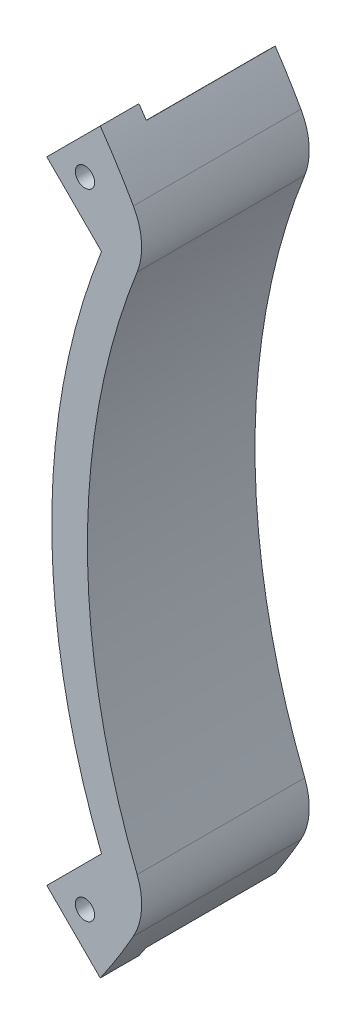
from build123d import *
from build123d.topology import SkipClean

# Parameters (mm, degrees)
CROQUIS1_R              = 100
SALIENTE_EXTRUIR1_DEPTH = 3
CROQUIS3_R              = 110
CORTAR_EXTRUIR1_DEPTH   = 3
REDONDEO1_R             = 10
CORTAR_EXTRUIR6_DEPTH   = 10
CROQUIS12_R             = 1.5
CORTAR_EXTRUIR7_DEPTH   = 142.453172607
CROQUIS9_R              = 1.5
CROQUIS9_W              = 4.5
CROQUIS9_H              = 8
CROQUIS9_W_2            = 8
CROQUIS9_H_2            = 4.5
CORTAR_EXTRUIR5_DEPTH   = 10
CORTAR_EXTRUIR8_DEPTH   = 142.453172607
CROQUIS16_R             = 1.5
CORTAR_EXTRUIR9_DEPTH   = 106.376884656
SALIENTE_EXTRUIR4_DEPTH = 23
SALIENTE_EXTRUIR9_START = 23
SALIENTE_EXTRUIR9_DEPTH = 23
CORTAR_EXTRUIR12_DEPTH  = 20


with BuildPart() as part:
    # Croquis1 → Saliente-Extruir1 (new body)
    with BuildSketch(Plane.XY):
        Circle(CROQUIS1_R)
    extrude(amount=SALIENTE_EXTRUIR1_DEPTH)

    # Croquis3 → Cortar-Extruir1 (cut)
    with BuildSketch(Plane.XY.offset(3)):
        with Locations((190, 0)):
            Circle(CROQUIS3_R)
    extrude(amount=-CORTAR_EXTRUIR1_DEPTH, mode=Mode.SUBTRACT)

    # Redondeo1
    redondeo1_edges = [part.edges().sort_by_distance(p)[0] for p in [
        (89.473684211, -44.659375654, 1.5),
        (89.473684211, 44.659375654, 1.5),
    ]]
    fillet(redondeo1_edges, radius=REDONDEO1_R)

    # Croquis5 → Cortar-Extruir6 (cut)
    with BuildSketch(Plane.XY.offset(3)):
        Polygon((-58.336309448, -83.085046789), (-83.085046789, -58.336309448), (-65.40737726, -40.658639918), (-40.658639918, -65.40737726), align=None)
        Polygon((-83.085046789, 58.336309448), (-58.336309448, 83.085046789), (-40.658639918, 65.40737726), (-65.40737726, 40.658639918), align=None)
        Polygon((58.336309448, -83.085046789), (83.085046789, -58.336309448), (65.40737726, -40.658639918), (40.658639918, -65.40737726), align=None)
        Polygon((58.336309448, 83.085046789), (83.085046789, 58.336309448), (65.40737726, 40.658639918), (40.658639918, 65.40737726), align=None)
    extrude(amount=-CORTAR_EXTRUIR6_DEPTH, mode=Mode.SUBTRACT)

    # Croquis12 → Cortar-Extruir7 (cut, through all)
    with BuildSketch(Plane.XY.offset(3)):
        with Locations((-63.604254904, -36.804908024)):
            Circle(CROQUIS12_R)
        with Locations((-36.804907897, -63.604255031)):
            Circle(CROQUIS12_R)
        with Locations((-47.666068056, -20.866721176)):
            Circle(CROQUIS12_R)
        with Locations((-20.866721049, -47.666068183)):
            Circle(CROQUIS12_R)
        with Locations((47.666068183, 20.866721049)):
            Circle(CROQUIS12_R)
        with Locations((20.866721176, 47.666068056)):
            Circle(CROQUIS12_R)
        with Locations((63.604255031, 36.804907897)):
            Circle(CROQUIS12_R)
        with Locations((36.804908024, 63.604254904)):
            Circle(CROQUIS12_R)
        with Locations((20.866721325, -47.666067908)):
            Circle(CROQUIS12_R)
        with Locations((47.666068332, -20.866720901)):
            Circle(CROQUIS12_R)
        with Locations((63.60425518, -36.804907749)):
            Circle(CROQUIS12_R)
        with Locations((36.804908173, -63.604254756)):
            Circle(CROQUIS12_R)
        with Locations((-63.604254756, 36.804908173)):
            Circle(CROQUIS12_R)
        with Locations((-36.804907749, 63.60425518)):
            Circle(CROQUIS12_R)
        with Locations((-20.866720901, 47.666068332)):
            Circle(CROQUIS12_R)
        with Locations((-47.666067908, 20.866721325)):
            Circle(CROQUIS12_R)
    extrude(amount=-CORTAR_EXTRUIR7_DEPTH, mode=Mode.SUBTRACT)

    # Croquis9 → Cortar-Extruir5 (cut)
    with BuildSketch(Plane.XY.offset(3)):
        with Locations((71.9, -4)):
            Circle(CROQUIS9_R)
        with Locations((35.959143483, 4)):
            Circle(CROQUIS9_R)
        with Locations((71.959143483, 4)):
            Circle(CROQUIS9_R)
        with Locations((35.9, -4)):
            Circle(CROQUIS9_R)
        with Locations((-91.190074744, 4)):
            Circle(CROQUIS9_R)
        with Locations((-91.190074744, -4)):
            Circle(CROQUIS9_R)
        with Locations((-55.190074744, 4)):
            Circle(CROQUIS9_R)
        with Locations((-55.190074744, -4)):
            Circle(CROQUIS9_R)
        with Locations((-4, 85)):
            Circle(CROQUIS9_R)
        with Locations((4, 85)):
            Circle(CROQUIS9_R)
        with Locations((-4, 49)):
            Circle(CROQUIS9_R)
        with Locations((4, 49)):
            Circle(CROQUIS9_R)
        with Locations((-4, -49)):
            Circle(CROQUIS9_R)
        with Locations((4, -49)):
            Circle(CROQUIS9_R)
        with Locations((4, -85)):
            Circle(CROQUIS9_R)
        with Locations((-4, -85)):
            Circle(CROQUIS9_R)
        with Locations((41.209143483, 0)):
            Rectangle(CROQUIS9_W, CROQUIS9_H)
        with Locations((0, -54.25)):
            Rectangle(CROQUIS9_W_2, CROQUIS9_H_2)
        with Locations((-60.440074744, 0)):
            Rectangle(CROQUIS9_W, CROQUIS9_H)
        with Locations((0, 54.25)):
            Rectangle(CROQUIS9_W_2, CROQUIS9_H_2)
    extrude(amount=-CORTAR_EXTRUIR5_DEPTH, mode=Mode.SUBTRACT)

    # Croquis13 → Cortar-Extruir8 (cut, through all)
    with BuildSketch(Plane.XY.offset(3)):
        with BuildLine():
            Line((40.658639918, 65.40737726), (57.245132907, 81.993870249))
            ThreePointArc((57.245132907, 81.993870249), (0, 100), (-57.245132907, 81.993870249))
            Line((-57.245132907, 81.993870249), (-40.658639918, 65.40737726))
            Line((-40.658639918, 65.40737726), (-65.40737726, 40.658639918))
            Line((-65.40737726, 40.658639918), (-81.993870249, 57.245132907))
            ThreePointArc((-81.993870249, 57.245132907), (-100, 0), (-81.993870249, -57.245132907))
            Line((-81.993870249, -57.245132907), (-65.40737726, -40.658639918))
            Line((-65.40737726, -40.658639918), (-40.658639918, -65.40737726))
            Line((-40.658639918, -65.40737726), (-57.245132907, -81.993870249))
            ThreePointArc((-57.245132907, -81.993870249), (0, -100), (57.245132907, -81.993870249))
            Line((57.245132907, -81.993870249), (40.658639918, -65.40737726))
            Line((40.658639918, -65.40737726), (65.40737726, -40.658639918))
            Line((65.40737726, -40.658639918), (73.700623754, -48.951886413))
            Line((73.700623754, -48.951886413), (82.185905129, -40.466605039))
            ThreePointArc((82.185905129, -40.466605039), (74.472042394, 0), (82.185905129, 40.466605039))
            Line((82.185905129, 40.466605039), (73.700623754, 48.951886413))
            Line((73.700623754, 48.951886413), (65.40737726, 40.658639918))
            Line((65.40737726, 40.658639918), (40.658639918, 65.40737726))
        make_face()
    extrude(amount=-CORTAR_EXTRUIR8_DEPTH, mode=Mode.SUBTRACT)

    # Croquis16 → Cortar-Extruir9 (cut, through all)
    with BuildSketch(Plane(origin=(0, 0, 0), x_dir=(-1, 0, 0), z_dir=(0, 0, -1))):
        with Locations((-79.619107513, -49.213515922)):
            Circle(CROQUIS16_R)
        with Locations((-79.620014024, 49.214422433)):
            Circle(CROQUIS16_R)
    extrude(amount=-CORTAR_EXTRUIR9_DEPTH, mode=Mode.SUBTRACT)

    # Croquis17 → Saliente-Extruir4 (add)
    with SkipClean():  # the faces are left unmerged after this step: merging them gives an invalid solid
        with BuildSketch(Plane(origin=(0, 0, 0), x_dir=(-1, 0, 0), z_dir=(0, 0, -1))):
            with BuildLine():
                ThreePointArc((-87.134502924, 49.067080616), (-74.472042394, 0), (-87.134502924, -49.067080616))
                ThreePointArc((-87.134502924, -49.067080616), (-88.3979419, -44.839843317), (-87.719298246, -40.480341508))
                ThreePointArc((-87.719298246, -40.480341508), (-80, 0), (-87.719298246, 40.480341508))
                ThreePointArc((-87.719298246, 40.480341508), (-88.3979419, 44.839843317), (-87.134502924, 49.067080616))
            make_face()
        extrude(amount=SALIENTE_EXTRUIR4_DEPTH)

    # Croquis19 → Saliente-Extruir9 (add)
    with SkipClean():  # the faces are left unmerged after this step: merging them gives an invalid solid
        with BuildSketch(Plane(origin=(0, 0, 0), x_dir=(-1, 0, 0), z_dir=(0, 0, -1)).offset(SALIENTE_EXTRUIR9_START)):
            with BuildLine():
                Line((-81.993870249, -57.245132907), (-80.578491296, -55.829753954))
                Line((-80.578491296, -55.829753954), (-86.470047942, -47.845734499))
                Line((-86.470047942, -47.845734499), (-87.134502924, -49.067080616))
                ThreePointArc((-87.134502924, -49.067080616), (-84.662989481, -53.218213162), (-81.993870249, -57.245132907))
            make_face()
            with BuildLine():
                Line((-81.993870249, 57.245132907), (-80.578491296, 55.829753954))
                Line((-80.578491296, 55.829753954), (-86.470047942, 47.845734499))
                Line((-86.470047942, 47.845734499), (-87.134502924, 49.067080616))
                ThreePointArc((-87.134502924, 49.067080616), (-84.662989481, 53.218213162), (-81.993870249, 57.245132907))
            make_face()
        extrude(amount=-SALIENTE_EXTRUIR9_DEPTH)

    # Croquis21 → Cortar-Extruir12 (cut)
    with SkipClean():  # the faces are left unmerged after this step: merging them gives an invalid solid
        with BuildSketch(Plane(origin=(0, 0, -23), x_dir=(-1, 0, 0), z_dir=(0, 0, -1))):
            with BuildLine():
                Line((-80.578491296, -55.829753954), (-81.768004725, -54.217769392))
                Line((-81.768004725, -54.217769392), (-83.120763907, -55.596210371))
                ThreePointArc((-83.120763907, -55.596210371), (-82.898820117, -56.654058957), (-81.993870249, -57.245132907))
                Line((-81.993870249, -57.245132907), (-80.578491296, -55.829753954))
            make_face()
            with BuildLine():
                Line((-80.578491296, 55.829753954), (-81.768004725, 54.217769392))
                Line((-81.768004725, 54.217769392), (-83.141306562, 55.565485178))
                ThreePointArc((-83.141306562, 55.565485178), (-82.91545484, 56.642950884), (-81.993870249, 57.245132907))
                Line((-81.993870249, 57.245132907), (-80.578491296, 55.829753954))
            make_face()
        extrude(amount=-CORTAR_EXTRUIR12_DEPTH, mode=Mode.SUBTRACT)


solid = part.part
